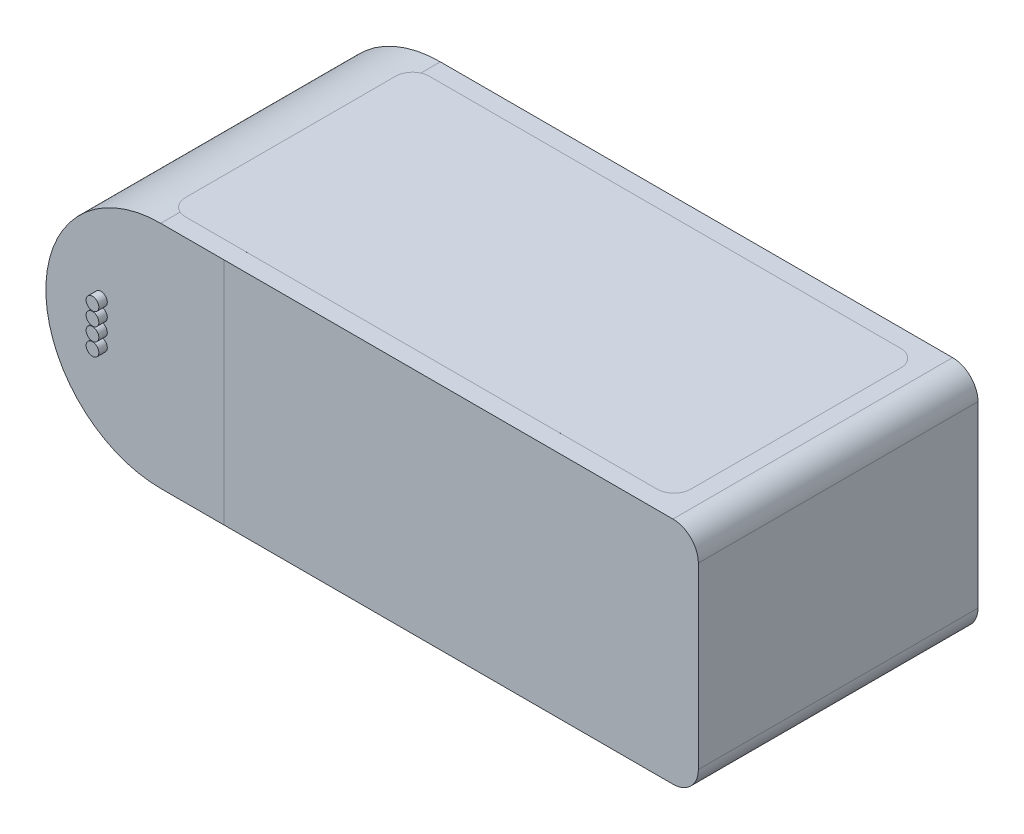
from build123d import *

# Parameters (mm, degrees)
ESBO_O1_W                = 77
ESBO_O1_H                = 33
RESSALTO_EXTRUS_O1_DEPTH = 13.55
FILETE1_RADIUS           = 13.55
FILETE1_LENGTH           = 33
FILETE2_R                = 3
ESBO_O2_R                = 0.75
RESSALTO_EXTRUS_O6_DEPTH = 1
ESBO_O3_R                = 2.05
RESSALTO_EXTRUS_O7_DEPTH = 2
RESSALTO_EXTRUS_O8_DEPTH = 0.001
RESSALTO_EXTRUS_O9_DEPTH = 0.0001


with BuildPart() as part:
    # Esboço1 → Ressalto-extrusão1 (new, symmetric)
    with BuildSketch(Plane(origin=(0, 0, 0), x_dir=(1, 0, 0), z_dir=(0, 1, 0))):
        Rectangle(ESBO_O1_W, ESBO_O1_H)
    extrude(amount=RESSALTO_EXTRUS_O1_DEPTH, both=True)

    # Filete1: full round fillet: the end face becomes a half cylinder, R = half its width
    filete1_face = Plane((-38.5, 0, 0), x_dir=(0, 0, -1), z_dir=(-1, 0, 0))  # on the end face: x along it, z out of the body
    filete1_slab = filete1_face.offset(-FILETE1_RADIUS / 2) * Box(FILETE1_LENGTH, 2 * FILETE1_RADIUS, FILETE1_RADIUS, mode=Mode.PRIVATE)  # the body's end, R deep
    filete1_round = Plane((-24.95, 0, 0), x_dir=(-1, 0, 0), z_dir=(0, 0, -1)) * Cylinder(FILETE1_RADIUS, FILETE1_LENGTH, mode=Mode.PRIVATE)  # its axis R under the face
    add(filete1_slab - filete1_round, mode=Mode.SUBTRACT)

    # Filete2
    filete2_edges = [part.edges().sort_by_distance(p)[0] for p in [
        (38.5, 13.55, 0),
        (38.5, -13.55, 0),
    ]]
    fillet(filete2_edges, radius=FILETE2_R)

    # Esboço2 → Ressalto-extrusão6 (add)
    with BuildSketch(Plane.XY.offset(16.5)):
        with Locations(Location((-32, 2.325, 0), (0, 0, 180))):
            Circle(ESBO_O2_R)
        with Locations(Location((-32, 0.775, 0), (0, 0, 180))):
            Circle(ESBO_O2_R)
        with Locations(Location((-32, -0.775, 0), (0, 0, 180))):
            Circle(ESBO_O2_R)
        with Locations(Location((-32, -2.325, 0), (0, 0, 180))):
            Circle(ESBO_O2_R)
    extrude(amount=RESSALTO_EXTRUS_O6_DEPTH)

    # Esboço3 → Ressalto-extrusão7 (add)
    with BuildSketch(Plane(origin=(0, 0, -16.5), x_dir=(-1, 0, 0), z_dir=(0, 0, -1))):
        with Locations(Location((32, 2.325, 0), (0, 0, 180))):
            Circle(ESBO_O3_R)
        with Locations(Location((32, -2.325, 0), (0, 0, 180))):
            Circle(ESBO_O3_R)
    extrude(amount=RESSALTO_EXTRUS_O7_DEPTH)

    # Esboço4 → Ressalto-extrusão8 (add)
    with BuildSketch(Plane.XY.offset(16.5)):
        with BuildLine():
            Line((-17.5, -13.55), (-17.5, 13.55))
            Line((-17.5, 13.55), (-24.95, 13.55))
            ThreePointArc((-24.95, 13.55), (-38.5, 0), (-24.95, -13.55))
            Line((-24.95, -13.55), (-17.5, -13.55))
        make_face()
    ressalto_extrus_o8 = extrude(amount=RESSALTO_EXTRUS_O8_DEPTH)

    # Espelhar1: Ressalto-extrusão8 across plane
    add(ressalto_extrus_o8.mirror(Plane.XY))

    # Esboço6 → Ressalto-extrusão9 (add)
    with BuildSketch(Plane(origin=(0, 13.55, 0), x_dir=(1, 0, 0), z_dir=(0, 1, 0))):
        with BuildLine():
            Line((-24.12, 14.381), (31.5, 14.381))
            ThreePointArc((31.5, 14.381), (32.914213562, 13.795213562), (33.5, 12.381))
            Line((33.5, 12.381), (33.5, -12.381))
            ThreePointArc((33.5, -12.381), (32.914213562, -13.795213562), (31.5, -14.381))
            Line((31.5, -14.381), (-24.12, -14.381))
            ThreePointArc((-24.12, -14.381), (-25.534213562, -13.795213562), (-26.12, -12.381))
            Line((-26.12, -12.381), (-26.12, 12.381))
            ThreePointArc((-26.12, 12.381), (-25.534213562, 13.795213562), (-24.12, 14.381))
        make_face()
    extrude(amount=RESSALTO_EXTRUS_O9_DEPTH)


solid = part.part
